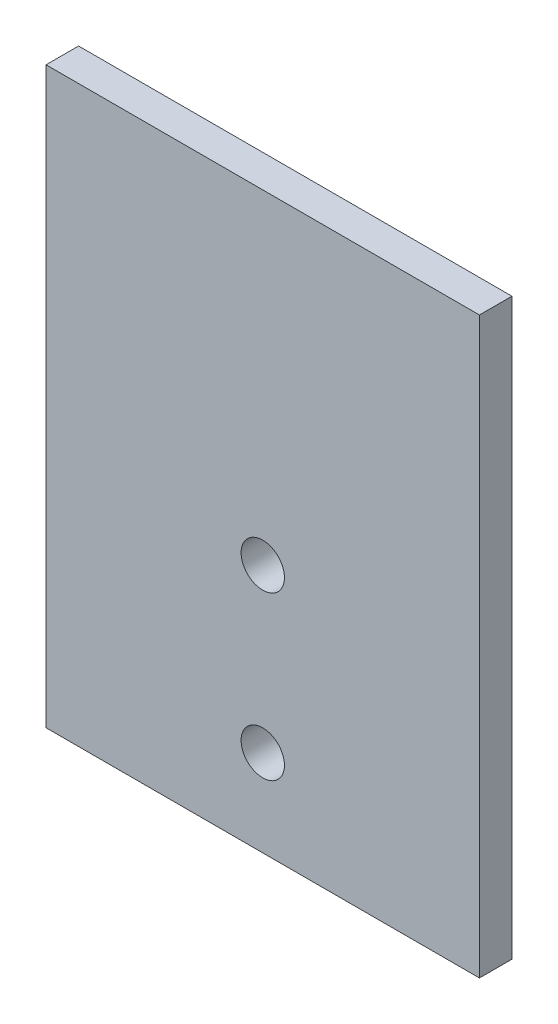
from build123d import *

# Parameters (mm, degrees)
SCHIZZO1_W                   = 40
SCHIZZO1_H                   = 53
ESTRUSIONE_ESTRUSIONE1_DEPTH = 3
SCHIZZO2_R                   = 2
TAGLIO_ESTRUSIONE1_DEPTH     = 34.335416602


with BuildPart() as part:
    # Schizzo1 → Estrusione-Estrusione1 (new body)
    with BuildSketch(Plane.XY):
        Rectangle(SCHIZZO1_W, SCHIZZO1_H)
    extrude(amount=ESTRUSIONE_ESTRUSIONE1_DEPTH)

    # Schizzo2 → Taglio-Estrusione1 (cut, through all)
    with BuildSketch(Plane.XY.offset(3)):
        with Locations((0, -18.5)):
            Circle(SCHIZZO2_R)
        with Locations((0, -3.5)):
            Circle(SCHIZZO2_R)
    extrude(amount=-TAGLIO_ESTRUSIONE1_DEPTH, mode=Mode.SUBTRACT)


solid = part.part
